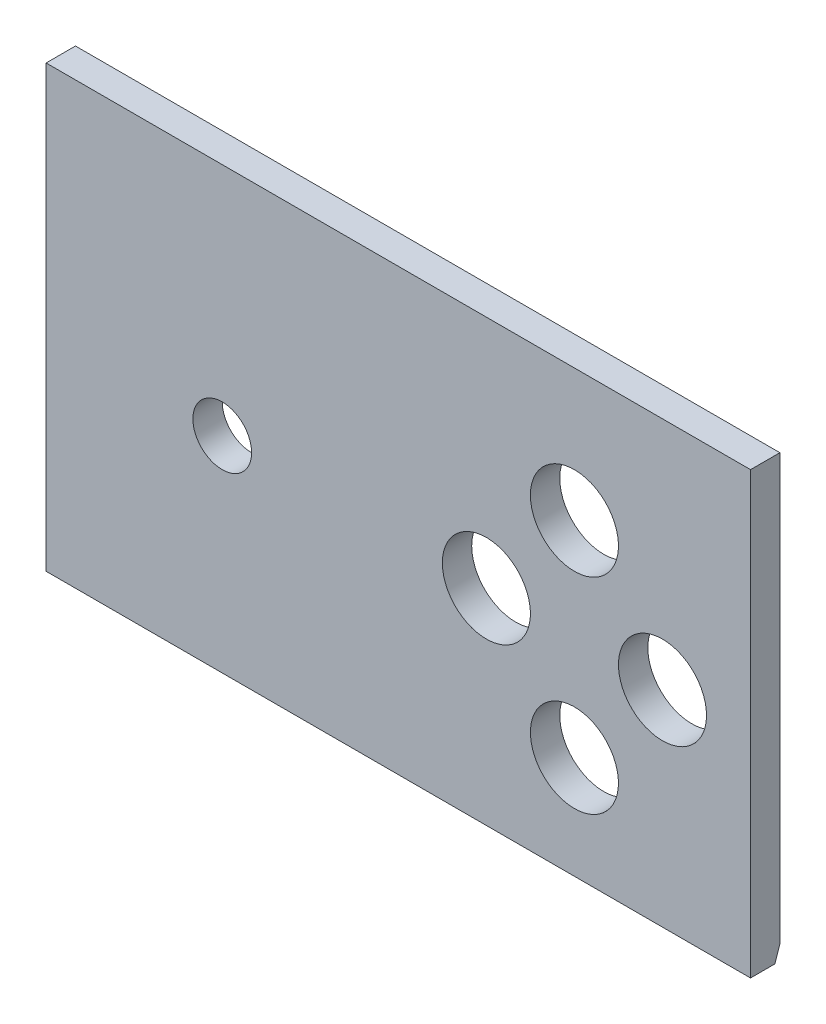
from build123d import *

# Parameters (mm, degrees)
CROQUIS2_W              = 240
CROQUIS2_H              = 150
CROQUIS2_R              = 10
CROQUIS2_R_2            = 15
SALIENTE_EXTRUIR2_DEPTH = 10
CORTAR_EXTRUIR1_DEPTH   = 240
CORTAR_EXTRUIR2_DEPTH   = 240


with BuildPart() as part:
    # Croquis2 → Saliente-Extruir2 (new body)
    with BuildSketch(Plane.XY):
        with Locations((120, 75)):
            Rectangle(CROQUIS2_W, CROQUIS2_H)
        with Locations((60, 70)):
            Circle(CROQUIS2_R, mode=Mode.SUBTRACT)
        with Locations((180, 35)):
            Circle(CROQUIS2_R_2, mode=Mode.SUBTRACT)
        with Locations((210, 70)):
            Circle(CROQUIS2_R_2, mode=Mode.SUBTRACT)
        with Locations(Location((150, 70, 0), (0, 0, 180))):
            Circle(CROQUIS2_R_2, mode=Mode.SUBTRACT)
        with Locations(Location((180, 105, 0), (0, 0, 180))):
            Circle(CROQUIS2_R_2, mode=Mode.SUBTRACT)
    extrude(amount=SALIENTE_EXTRUIR2_DEPTH)

    # Croquis4 → Cortar-Extruir1 (cut)
    with BuildSketch(Plane(origin=(240, 0, 0), x_dir=(0, 0, -1), z_dir=(1, 0, 0))):
        Polygon((-0.025530109, 4.943381022), (-1.679665648, 0), (0, 0), align=None)
    extrude(amount=-CORTAR_EXTRUIR1_DEPTH, mode=Mode.SUBTRACT)

    # Croquis6 → Cortar-Extruir2 (cut)
    with BuildSketch(Plane(origin=(240, 0, 0), x_dir=(0, 0, -1), z_dir=(1, 0, 0))):
        Polygon((-0.025530109, 4.943381022), (0, 4.934838233), (0, -0.070345502), (-0.012765054, -0.070345502), align=None)
    extrude(amount=-CORTAR_EXTRUIR2_DEPTH, mode=Mode.SUBTRACT)


solid = part.part
